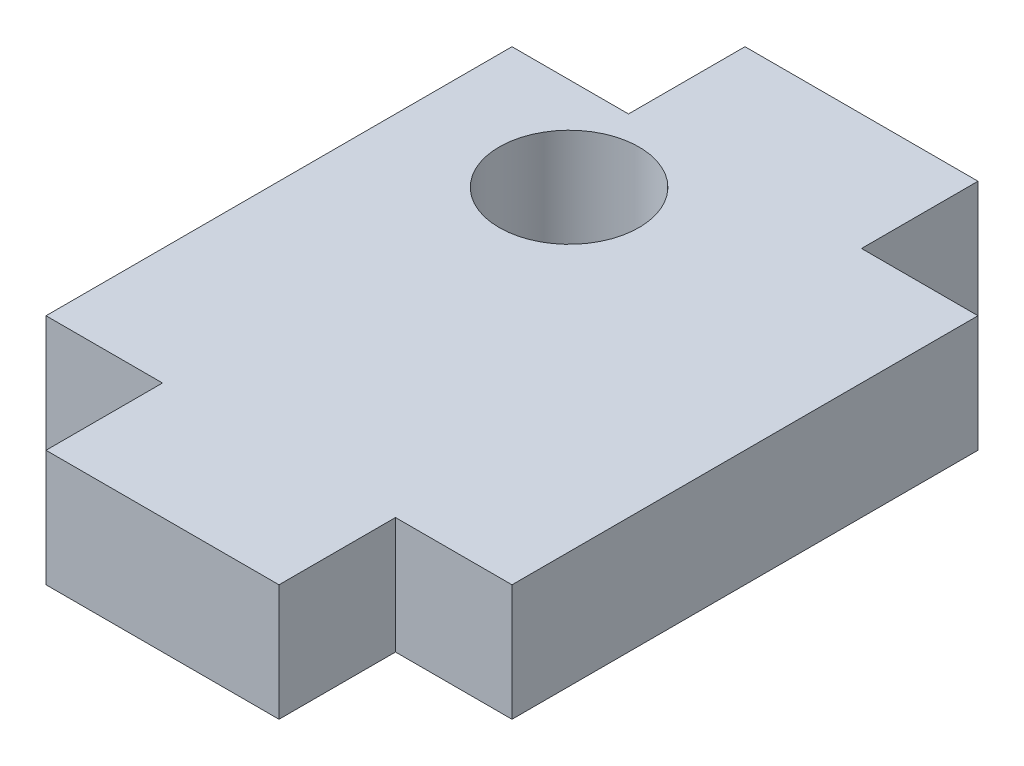
from build123d import *

# Parameters (mm, degrees)
SKETCH_1_R      = 3
EXTRUDE_1_DEPTH = 5


with BuildPart() as part:
    # 草图1 → 凸台-拉伸1 (new body)
    with BuildSketch(Plane(origin=(0, 0, 0), x_dir=(1, 0, 0), z_dir=(0, 1, 0))):
        Polygon((0, 0), (5, 0), (5, -5), (15, -5), (15, 0), (20, 0), (20, 20), (15, 20), (15, 25), (5, 25), (5, 20), (0, 20), align=None)
        with Locations(Location((6.45, 16, 0), (0, 0, 270))):
            Circle(SKETCH_1_R, mode=Mode.SUBTRACT)
    extrude(amount=EXTRUDE_1_DEPTH)


solid = part.part
